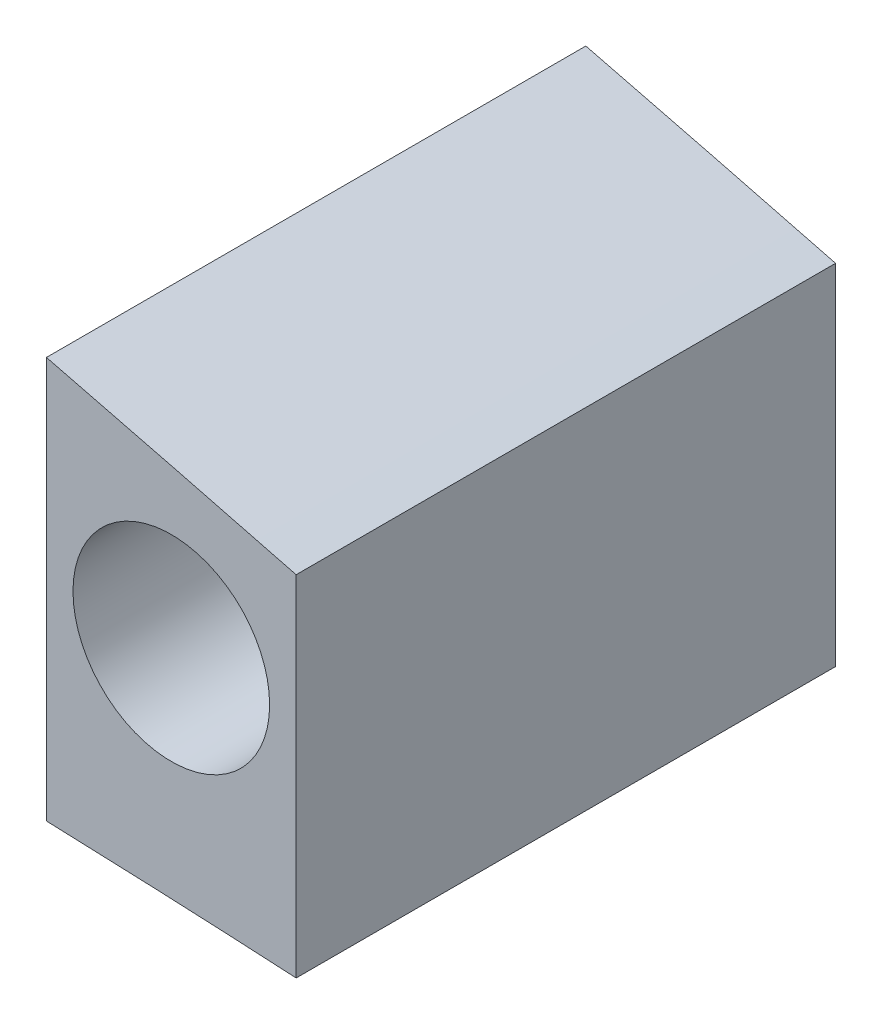
from build123d import *

# Parameters (mm, degrees)
BOSS_EXTRUDE1_DEPTH = 27.432
SKETCH2_R           = 6.35
SKETCH2_R_2         = 5
SKETCH2_W           = 157.234350826
SKETCH2_H           = 154.50631004
CUT_EXTRUDE1_DEPTH  = 317.917465392
SKETCH3_W           = 293.18888876
SKETCH3_H           = 137.971241769
CUT_EXTRUDE2_DEPTH  = 241.147718716


with BuildPart() as part:
    # Sketch1 → Boss-Extrude1 (new body)
    with BuildSketch(Plane.XY):
        with BuildLine():
            add(Edge.make_bspline(
                [(0.000560351, 0.000130087), (0.810633127, 7.359196055), (8.649092025, 17.856605174), (26.286719818, 29.975176328), (52.111128271, 42.069215275), (89.597618475, 49.290763054), (131.400792109, 47.884831915), (173.256699242, 40.041104278), (217.961060472, 29.612974894), (256.952064401, 19.528920948), (290.35983767, 8.71099439), (301.273197721, 4.382828139), (314.816918223, -0.516206742), (309.846313895, 0.000130087)],
                knots=[0, 0, 0, 0, 0.060863618, 0.113688265, 0.188608742, 0.312908923, 0.448482434, 0.557612135, 0.691544113, 0.852438279, 0.92975597, 0.976058229, 1, 1, 1, 1], degree=3))
            add(Edge.make_bspline(
                [(309.846313895, 0.000130087), (303.956832565, 1.47095521), (293.989507544, 2.093987313), (276.26402299, 4.514356704), (260.846344817, 5.427413394), (235.858814759, 7.870306192), (205.101424636, 8.838080282), (157.718638092, 9.030650149), (110.497331172, 6.181495223), (66.506197185, -0.586669107), (36.454672816, -6.098499901), (15.316603331, -6.189065841), (1.230714189, -6.924076091), (0.000560351, 0.000130087)],
                knots=[0, 0, 0, 0, 0.057787081, 0.095274891, 0.171021118, 0.205339302, 0.335319146, 0.464904334, 0.658702312, 0.785511947, 0.893517288, 0.94309214, 1, 1, 1, 1], degree=3))
        make_face()
    extrude(amount=BOSS_EXTRUDE1_DEPTH)

    # Sketch2 → Cut-Extrude1 (cut, through all)
    with BuildSketch(Plane.XY.offset(27.432)):
        with Locations((20.32, 10.16)):
            Circle(SKETCH2_R)
        with Locations((227.296313895, 19.050130087)):
            Circle(SKETCH2_R_2)
        with Locations((312.263489308, 28.906285069)):
            Rectangle(SKETCH2_W, SKETCH2_H)
    extrude(amount=-CUT_EXTRUDE1_DEPTH, mode=Mode.SUBTRACT)

    # Sketch3 → Cut-Extrude2 (cut, through all)
    with BuildSketch(Plane.XY.offset(27.432)):
        with Locations((74.351869515, 11.449549126)):
            Rectangle(SKETCH3_W, SKETCH3_H)
    extrude(amount=-CUT_EXTRUDE2_DEPTH, mode=Mode.SUBTRACT)


solid = part.part
